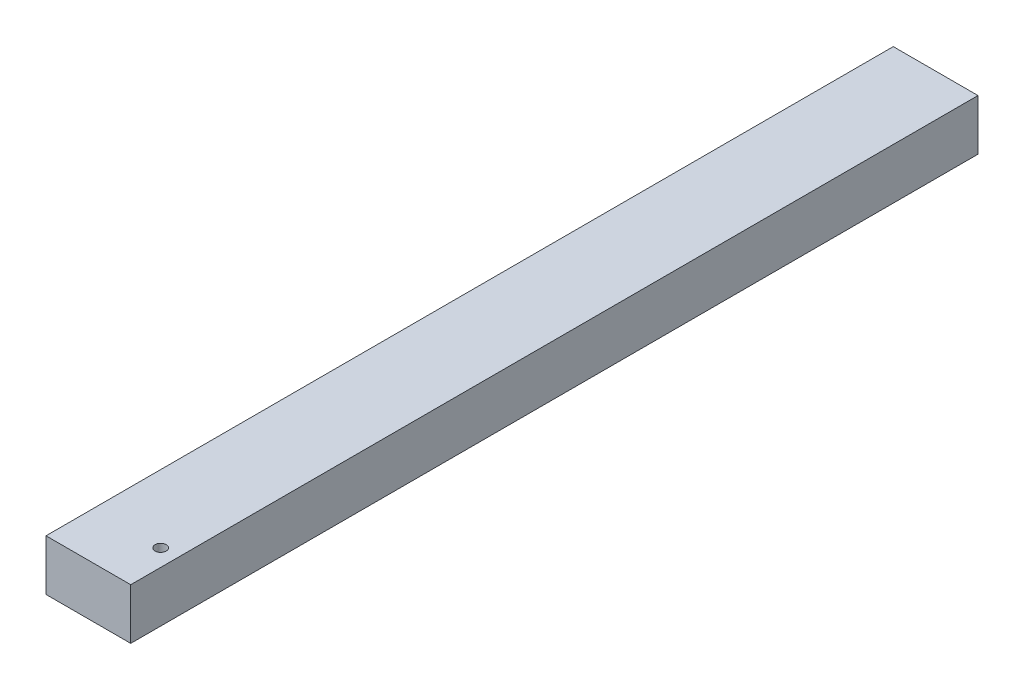
from build123d import *

# Parameters (mm, degrees)
SKETCH1_W            = 50
SKETCH1_H            = 30
BOSS_EXTRUDE1_DEPTH  = 500
M6_CLEARANCE_HOLE1_D = 6.6


with BuildPart() as part:
    # Sketch1 → Boss-Extrude1 (new body)
    with BuildSketch(Plane.XY):
        with Locations((-25, 15)):
            Rectangle(SKETCH1_W, SKETCH1_H)
    extrude(amount=BOSS_EXTRUDE1_DEPTH)

    # M6 Clearance Hole1 (through all)
    with Locations(Plane(origin=(-10, 30, 472.328033339), x_dir=(1, 0, 0), z_dir=(0, 1, 0))):
        with Locations((0, 0)):
            Hole(M6_CLEARANCE_HOLE1_D / 2)


solid = part.part
